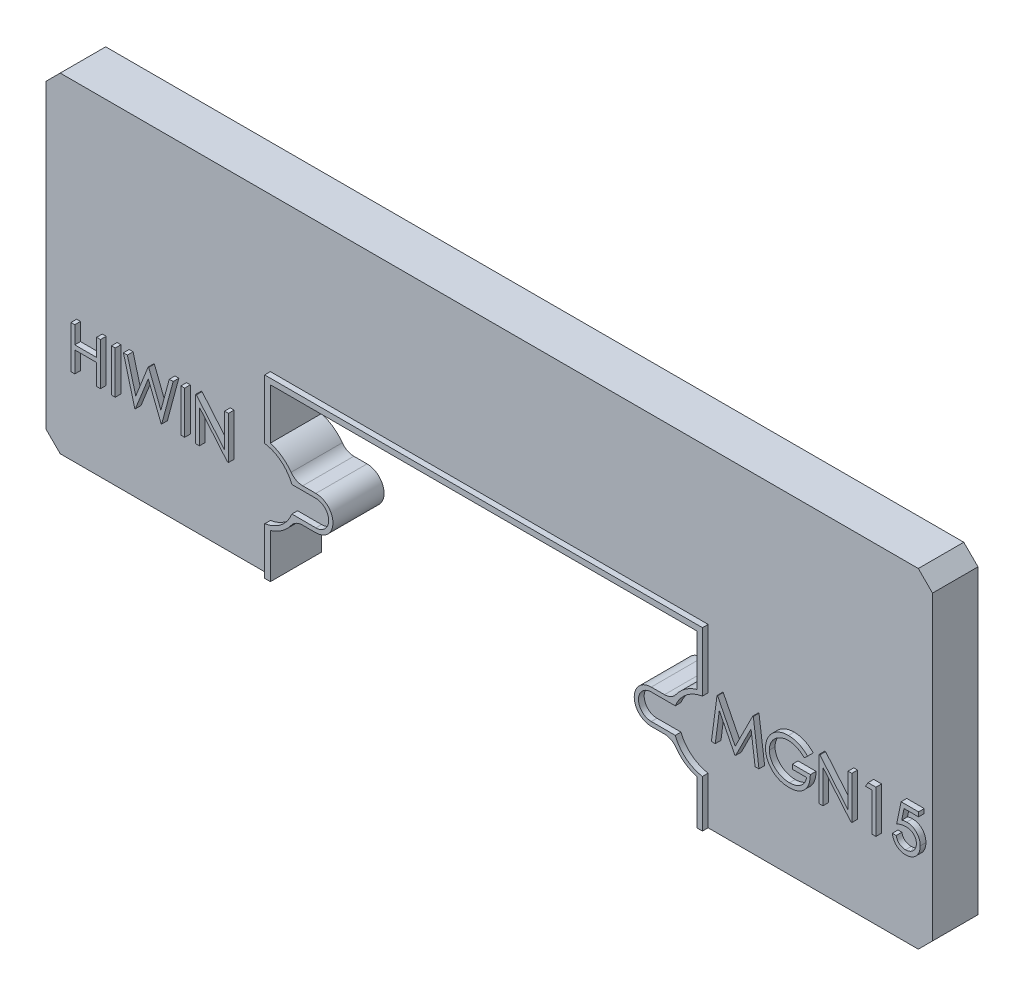
from build123d import *

# Parameters (mm, degrees)
BOSS_EXTRUDE1_DEPTH = 1.6
FILLET1_R           = 0.5
BOSS_EXTRUDE3_START = 0.2
BOSS_EXTRUDE3_DEPTH = 0.2
SKETCH3_W           = 0.134615385
SKETCH3_H           = 1.5
SKETCH3_W_2         = 0.134615384
BOSS_EXTRUDE4_DEPTH = 0.2


with BuildPart() as part:
    # Sketch1 → Boss-Extrude1 (new body)
    with BuildSketch(Plane.XY):
        with BuildLine():
            ThreePointArc((6.647274571, -2.31), (6.997318767, -1.854307057), (7.501849233, -1.579287046))
            Line((7.501849233, -1.579287046), (7.501849233, 0.2))
            Line((7.501849233, 0.2), (-7.501849233, 0.2))
            Line((-7.501849233, 0.2), (-7.501849233, -1.579287046))
            ThreePointArc((-7.501849233, -1.579287046), (-6.997318767, -1.854307057), (-6.647274571, -2.31))
            Line((-6.647274571, -2.31), (-5.9, -2.31))
            ThreePointArc((-5.9, -2.31), (-5.3, -2.91), (-5.9, -3.51))
            Line((-5.9, -3.51), (-6.647274571, -3.51))
            ThreePointArc((-6.647274571, -3.51), (-6.996585307, -3.96506535), (-7.5, -4.240158261))
            Line((-7.5, -4.240158261), (-7.5, -5.8))
            Line((-7.5, -5.8), (-15.095, -5.8))
            Line((-15.095, -5.8), (-15.595, -5.3))
            Line((-15.595, -5.3), (-15.595, 5.3))
            Line((-15.595, 5.3), (-15.095, 5.8))
            Line((-15.095, 5.8), (15.095, 5.8))
            Line((15.095, 5.8), (15.595, 5.3))
            Line((15.595, 5.3), (15.595, -5.3))
            Line((15.595, -5.3), (15.095, -5.8))
            Line((15.095, -5.8), (7.5, -5.8))
            Line((7.5, -5.8), (7.5, -4.240158261))
            ThreePointArc((7.5, -4.240158261), (6.996585307, -3.96506535), (6.647274571, -3.51))
            Line((6.647274571, -3.51), (5.9, -3.51))
            ThreePointArc((5.9, -3.51), (5.3, -2.91), (5.9, -2.31))
            Line((5.9, -2.31), (6.647274571, -2.31))
        make_face()
    extrude(amount=-BOSS_EXTRUDE1_DEPTH)

    # Fillet1
    fillet1_edges = [part.edges().sort_by_distance(p)[0] for p in [
        (-6.647274571, -2.31, -0.8),
        (-6.647274571, -3.51, -0.8),
        (6.647274571, -3.51, -0.8),
        (6.647274571, -2.31, -0.8),
    ]]
    fillet(fillet1_edges, radius=FILLET1_R)

    # Sketch2 → Boss-Extrude3 (add)
    with BuildSketch(Plane.XY.offset(BOSS_EXTRUDE3_START)):
        with BuildLine():
            Line((-7.5, -5.8), (-7.7, -5.8))
            Line((-7.7, -5.8), (-7.7, -4.133764683))
            ThreePointArc((-7.7, -4.133764683), (-7.119615817, -3.87363921), (-6.744534726, -3.36))
            Line((-6.744534726, -3.36), (-5.9, -3.36))
            ThreePointArc((-5.9, -3.36), (-5.45, -2.91), (-5.9, -2.46))
            Line((-5.9, -2.46), (-6.744534726, -2.46))
            ThreePointArc((-6.744534726, -2.46), (-7.120344028, -1.945771518), (-7.701849233, -1.685934531))
            Line((-7.701849233, -1.685934531), (-7.701849233, 0.4))
            Line((-7.701849233, 0.4), (7.701849233, 0.4))
            Line((7.701849233, 0.4), (7.701849233, -1.685934531))
            ThreePointArc((7.701849233, -1.685934531), (7.120344028, -1.945771518), (6.744534726, -2.46))
            Line((6.744534726, -2.46), (5.9, -2.46))
            ThreePointArc((5.9, -2.46), (5.45, -2.91), (5.9, -3.36))
            Line((5.9, -3.36), (6.744534726, -3.36))
            ThreePointArc((6.744534726, -3.36), (7.119615817, -3.87363921), (7.7, -4.133764683))
            Line((7.7, -4.133764683), (7.7, -5.8))
            Line((7.7, -5.8), (7.5, -5.8))
            Line((7.5, -5.8), (7.5, -4.240158261))
            ThreePointArc((7.5, -4.240158261), (7.092189431, -4.039939416), (6.770797719, -3.718840656))
            ThreePointArc((6.770797719, -3.718840656), (6.592812851, -3.565264308), (6.364317416, -3.51))
            Line((6.364317416, -3.51), (5.9, -3.51))
            ThreePointArc((5.9, -3.51), (5.3, -2.91), (5.9, -2.31))
            Line((5.9, -2.31), (6.364317416, -2.31))
            ThreePointArc((6.364317416, -2.31), (6.592812851, -2.254735692), (6.770797719, -2.101159344))
            ThreePointArc((6.770797719, -2.101159344), (7.092974903, -1.779499451), (7.501849233, -1.579287046))
            Line((7.501849233, -1.579287046), (7.501849233, 0.2))
            Line((7.501849233, 0.2), (-7.501849233, 0.2))
            Line((-7.501849233, 0.2), (-7.501849233, -1.579287046))
            ThreePointArc((-7.501849233, -1.579287046), (-7.092974903, -1.779499451), (-6.770797719, -2.101159344))
            ThreePointArc((-6.770797719, -2.101159344), (-6.592812851, -2.254735692), (-6.364317416, -2.31))
            Line((-6.364317416, -2.31), (-5.9, -2.31))
            ThreePointArc((-5.9, -2.31), (-5.3, -2.91), (-5.9, -3.51))
            Line((-5.9, -3.51), (-6.364317416, -3.51))
            ThreePointArc((-6.364317416, -3.51), (-6.592812851, -3.565264308), (-6.770797719, -3.718840656))
            ThreePointArc((-6.770797719, -3.718840656), (-7.092189431, -4.039939416), (-7.5, -4.240158261))
            Line((-7.5, -4.240158261), (-7.5, -5.8))
        make_face()
    extrude(amount=-BOSS_EXTRUDE3_DEPTH)

    # Sketch3 → Boss-Extrude4 (add)
    with BuildSketch(Plane.XY):
        Polygon((-10.132115385, -2.91), (-10.132115385, -1.41), (-10.103870192, -1.41), (-9.112884615, -2.590588942), (-9.112884615, -1.41), (-8.978269231, -1.41), (-8.978269231, -2.91), (-9.008918269, -2.91), (-9.9975, -1.732115385), (-9.9975, -2.91), align=None)
        with Locations((-10.584038462, -2.16)):
            Rectangle(SKETCH3_W, SKETCH3_H)
        Polygon((-12.670576923, -1.41), (-12.531454327, -1.41), (-12.237884615, -2.510060096), (-11.801286058, -1.41), (-11.781754808, -1.41), (-11.353269231, -2.502548077), (-11.058197115, -1.41), (-10.920576923, -1.41), (-11.325024038, -2.91), (-11.344254808, -2.91), (-11.795576923, -1.762764423), (-12.252307692, -2.91), (-12.271538462, -2.91), align=None)
        with Locations((-13.026346154, -2.16)):
            Rectangle(SKETCH3_W_2, SKETCH3_H)
        Polygon((-14.516730769, -1.41), (-14.382115385, -1.41), (-14.382115385, -2.025384615), (-13.612884615, -2.025384615), (-13.612884615, -1.41), (-13.478269231, -1.41), (-13.478269231, -2.91), (-13.612884615, -2.91), (-13.612884615, -2.179230769), (-14.382115385, -2.179230769), (-14.382115385, -2.91), (-14.516730769, -2.91), align=None)
        Polygon((8.015384615, -2.91), (8.213401442, -1.41), (8.232632212, -1.41), (8.851923077, -2.640769231), (9.469711538, -1.41), (9.489242788, -1.41), (9.688461538, -2.91), (9.553245192, -2.91), (9.409615385, -1.830673077), (8.868149038, -2.91), (8.837800481, -2.91), (8.294230769, -1.828269231), (8.150901442, -2.91), align=None)
        with BuildLine():
            Line((11.4, -1.666009615), (11.284615385, -1.775384615))
            add(Edge.make_bspline(
                [(11.284615385, -1.775384615), (11.263735861, -1.755742817), (11.222474698, -1.71692759), (11.155206023, -1.666565735), (11.085021608, -1.623423121), (11.012287681, -1.588320448), (10.938805444, -1.560312122), (10.865550254, -1.54037149), (10.793273525, -1.527654689), (10.74520186, -1.526133959), (10.721514423, -1.525384615)],
                knots=[0, 0, 0, 0, 1.08915593, 2.152340314, 3.188132944, 4.216796309, 5.218260357, 6.173443236, 7.099959455, 8, 8, 8, 8], degree=3))
            add(Edge.make_bspline(
                [(10.721514423, -1.525384615), (10.706979552, -1.525561875), (10.677947506, -1.525915935), (10.634823815, -1.530434884), (10.5921524, -1.536934112), (10.55001381, -1.546337773), (10.508326116, -1.558255942), (10.467234305, -1.573163997), (10.426661725, -1.590544816), (10.386990547, -1.610628734), (10.348530331, -1.632691525), (10.312205973, -1.6571409), (10.277785945, -1.683193238), (10.245917191, -1.711500801), (10.216416397, -1.741807172), (10.18858138, -1.773548588), (10.163391111, -1.807592254), (10.140637754, -1.843311808), (10.120339918, -1.880079889), (10.102421924, -1.917542599), (10.087380314, -1.955575679), (10.075479119, -1.994226855), (10.065660268, -2.033197108), (10.058752722, -2.072756274), (10.054858412, -2.11294671), (10.054184792, -2.139859821), (10.053846154, -2.153389423)],
                knots=[0, 0, 0, 0, 1.02818874, 2.053710826, 3.065248034, 4.081641283, 5.106893873, 6.131558223, 7.173050175, 8.228653731, 9.27666206, 10.308777013, 11.325269123, 12.329503258, 13.32196095, 14.316845687, 15.314881793, 16.315733098, 17.311955233, 18.285320748, 19.252783886, 20.203351036, 21.145449891, 22.095197417, 23.042428769, 24, 24, 24, 24], degree=3))
            add(Edge.make_bspline(
                [(10.053846154, -2.153389423), (10.054170033, -2.167219773), (10.054816907, -2.194842708), (10.058957044, -2.236068739), (10.066640576, -2.276682483), (10.076912451, -2.316817397), (10.089761372, -2.356542217), (10.105778229, -2.395684722), (10.124749201, -2.434243461), (10.146707723, -2.471871011), (10.170787524, -2.508523735), (10.19776313, -2.543049244), (10.226417666, -2.575907292), (10.257795052, -2.606368333), (10.290889141, -2.635247146), (10.326688688, -2.661748084), (10.364489743, -2.686381608), (10.404349976, -2.70883726), (10.445836883, -2.728898061), (10.488375492, -2.746736873), (10.532101698, -2.761428018), (10.576785708, -2.773401491), (10.622374253, -2.783215904), (10.66909874, -2.789529824), (10.716615615, -2.794111609), (10.748646457, -2.79444661), (10.764783654, -2.794615385)],
                knots=[0, 0, 0, 0, 0.93586088, 1.869166235, 2.799637598, 3.729985548, 4.670839027, 5.622275134, 6.589130586, 7.576015415, 8.568469353, 9.55398029, 10.53834874, 11.515998671, 12.510579167, 13.508179873, 14.527009472, 15.561807829, 16.601455013, 17.643573243, 18.680854198, 19.719860599, 20.772568776, 21.833555941, 22.908541556, 24, 24, 24, 24], degree=3))
            add(Edge.make_bspline(
                [(10.764783654, -2.794615385), (10.784231517, -2.794208852), (10.822420556, -2.793410559), (10.878557603, -2.787196149), (10.932473204, -2.77749038), (10.984015863, -2.763276425), (11.033245443, -2.745146278), (11.080342418, -2.723291113), (11.124935986, -2.696872659), (11.167160203, -2.667055287), (11.20605614, -2.633834645), (11.241136479, -2.597987021), (11.271841689, -2.559686421), (11.298629417, -2.519158429), (11.320790269, -2.476067584), (11.338980038, -2.430625057), (11.352922877, -2.382810409), (11.358646438, -2.349771138), (11.361538462, -2.333076923)],
                knots=[0, 0, 0, 0, 1.13008108, 2.219097802, 3.278683437, 4.311054135, 5.322181354, 6.324827112, 7.324222904, 8.330512327, 9.32562643, 10.293043162, 11.24128371, 12.174520618, 13.111833804, 14.052305215, 15.015860969, 16, 16, 16, 16], degree=3))
            Line((11.361538462, -2.333076923), (10.861538462, -2.333076923))
            Line((10.861538462, -2.333076923), (10.861538462, -2.179230769))
            Line((10.861538462, -2.179230769), (11.496153846, -2.179230769))
            add(Edge.make_bspline(
                [(11.496153846, -2.179230769), (11.495422768, -2.207905407), (11.493991917, -2.264026854), (11.483955239, -2.345871256), (11.467748162, -2.42317341), (11.445608028, -2.496014726), (11.416947194, -2.56429198), (11.382073253, -2.628074494), (11.340428058, -2.686950215), (11.293495012, -2.741399788), (11.240823602, -2.78996945), (11.18383705, -2.832657709), (11.122441207, -2.868615973), (11.056694146, -2.897870543), (10.986811103, -2.920702255), (10.912630369, -2.936890073), (10.83425254, -2.946588629), (10.780536822, -2.947827792), (10.753064904, -2.948461538)],
                knots=[0, 0, 0, 0, 1.140356446, 2.231883559, 3.274166699, 4.278491846, 5.25512956, 6.21435461, 7.1637429, 8.11826594, 9.068280886, 10.0076534, 10.945064095, 11.891975133, 12.864533718, 13.863980011, 14.907571808, 16, 16, 16, 16], degree=3))
            add(Edge.make_bspline(
                [(10.753064904, -2.948461538), (10.736131989, -2.948217629), (10.702734823, -2.947736562), (10.653410139, -2.944317699), (10.605445445, -2.939054595), (10.558847727, -2.931106685), (10.51344558, -2.921371833), (10.469465758, -2.908906096), (10.426740725, -2.894476654), (10.385204446, -2.878064222), (10.345233926, -2.859047798), (10.306651133, -2.837915095), (10.269242793, -2.814775083), (10.233263723, -2.789227578), (10.198526456, -2.761463667), (10.16525498, -2.731427701), (10.133263033, -2.699211507), (10.113222834, -2.676334789), (10.103125, -2.664807692)],
                knots=[0, 0, 0, 0, 1.107784379, 2.184907829, 3.233506516, 4.263428166, 5.276301166, 6.270063455, 7.25232949, 8.225834625, 9.190232166, 10.146266622, 11.1027726, 12.066435141, 13.031522626, 14.010570082, 14.99756817, 16, 16, 16, 16], degree=3))
            add(Edge.make_bspline(
                [(10.103125, -2.664807692), (10.088473886, -2.64652027), (10.059414852, -2.610248977), (10.022009928, -2.552134715), (9.990123613, -2.491962489), (9.964251689, -2.429564791), (9.944049652, -2.364999985), (9.929561258, -2.298350575), (9.92107242, -2.229530733), (9.919849475, -2.182959906), (9.919230769, -2.159399038)],
                knots=[0, 0, 0, 0, 1.023165419, 2.029347347, 3.013907458, 3.994755782, 4.975994455, 5.96558838, 6.970761222, 8, 8, 8, 8], degree=3))
            add(Edge.make_bspline(
                [(9.919230769, -2.159399038), (9.919458871, -2.141756359), (9.919912176, -2.106695227), (9.925408826, -2.054642095), (9.933295148, -2.003513227), (9.944886743, -1.953350417), (9.959499428, -1.904120164), (9.977736636, -1.855799608), (9.998970163, -1.808360234), (10.023649661, -1.762128576), (10.05111443, -1.717718114), (10.080921667, -1.675307627), (10.113494639, -1.635669456), (10.14830141, -1.598301607), (10.185757263, -1.563673529), (10.225511301, -1.531464625), (10.267594163, -1.501631688), (10.31213824, -1.474644616), (10.358478676, -1.450403064), (10.406504391, -1.429150545), (10.456200724, -1.411586267), (10.507195357, -1.396683219), (10.559874286, -1.385662444), (10.613855231, -1.377670125), (10.669419564, -1.372201296), (10.706977863, -1.371761472), (10.726021635, -1.371538462)],
                knots=[0, 0, 0, 0, 1.008945113, 2.00506715, 2.99143336, 3.967273523, 4.948097931, 5.927297278, 6.919902385, 7.919676788, 8.923139349, 9.905703106, 10.883022732, 11.856032218, 12.825136022, 13.798837087, 14.781400844, 15.773989409, 16.776158564, 17.77167057, 18.775803737, 19.789618931, 20.80898985, 21.851988756, 22.910860228, 24, 24, 24, 24], degree=3))
            add(Edge.make_bspline(
                [(10.726021635, -1.371538462), (10.74155231, -1.371786815), (10.772347816, -1.372279271), (10.818173129, -1.375692692), (10.863290136, -1.381102927), (10.907765731, -1.388485835), (10.95144846, -1.398541702), (10.994462762, -1.410575253), (11.036870992, -1.424586034), (11.078540242, -1.44129554), (11.119750691, -1.460261379), (11.16073148, -1.481609989), (11.201342586, -1.505706419), (11.241654435, -1.53262222), (11.281921231, -1.561895113), (11.321506078, -1.594362324), (11.361364482, -1.628743505), (11.386993831, -1.653464441), (11.4, -1.666009615)],
                knots=[0, 0, 0, 0, 0.985871117, 1.954866573, 2.915460327, 3.869826059, 4.81536089, 5.759505086, 6.70452669, 7.649098992, 8.607881297, 9.583363685, 10.581137262, 11.603961102, 12.659522466, 13.73993555, 14.853081303, 16, 16, 16, 16], degree=3))
        make_face()
        Polygon((11.803846154, -2.91), (11.803846154, -1.41), (11.832091346, -1.41), (12.823076923, -2.590588942), (12.823076923, -1.41), (12.957692308, -1.41), (12.957692308, -2.91), (12.927043269, -2.91), (11.938461538, -1.732115385), (11.938461538, -2.91), align=None)
        Polygon((13.526502404, -1.41), (13.803846154, -1.41), (13.803846154, -2.91), (13.669230769, -2.91), (13.669230769, -1.563846154), (13.438461538, -1.563846154), align=None)
        with BuildLine():
            Line((15.303846154, -1.41), (15.303846154, -1.563846154))
            Line((15.303846154, -1.563846154), (14.793629808, -1.563846154))
            Line((14.793629808, -1.563846154), (14.712800481, -1.958377404))
            add(Edge.make_bspline(
                [(14.712800481, -1.958377404), (14.72868157, -1.953993002), (14.759448668, -1.945498916), (14.804860037, -1.936067871), (14.847970981, -1.930382681), (14.87594614, -1.929606405), (14.889483173, -1.929230769)],
                knots=[0, 0, 0, 0, 1.100273476, 2.13160584, 3.095893838, 4, 4, 4, 4], degree=3))
            add(Edge.make_bspline(
                [(14.889483173, -1.929230769), (14.906233347, -1.929593313), (14.939168375, -1.930306165), (14.987356495, -1.937151243), (15.033356306, -1.947925492), (15.077071608, -1.962977145), (15.118583272, -1.982224173), (15.15750937, -2.006267005), (15.19443419, -2.034352718), (15.228695302, -2.066643437), (15.259777148, -2.102181273), (15.287105429, -2.140391789), (15.310317968, -2.180903645), (15.328986863, -2.224103905), (15.343894435, -2.269514971), (15.353816718, -2.317614649), (15.360423879, -2.367949558), (15.361162045, -2.402365802), (15.361538462, -2.419915865)],
                knots=[0, 0, 0, 0, 1.052922333, 2.070308379, 3.05430497, 4.020497103, 4.973039431, 5.925935799, 6.892292201, 7.88610001, 8.88166317, 9.857072816, 10.836096531, 11.812156883, 12.81219415, 13.836441305, 14.89672472, 16, 16, 16, 16], degree=3))
            add(Edge.make_bspline(
                [(15.361538462, -2.419915865), (15.361253429, -2.432139674), (15.360687217, -2.456422097), (15.357807822, -2.492483898), (15.352263944, -2.527782255), (15.344820633, -2.562321851), (15.335159597, -2.596037296), (15.323464288, -2.629025094), (15.309151705, -2.661079926), (15.293452544, -2.692505095), (15.275775482, -2.722590169), (15.256156122, -2.750725449), (15.235428054, -2.777332999), (15.213124603, -2.802127456), (15.189038463, -2.824945892), (15.163461334, -2.845923727), (15.136597312, -2.865415725), (15.108030779, -2.882630666), (15.078398286, -2.898471933), (15.047271908, -2.911467735), (15.015360179, -2.923086533), (14.982203804, -2.932347759), (14.947877884, -2.939604568), (14.912325837, -2.944533397), (14.875734122, -2.948123298), (14.850930545, -2.948348023), (14.838401442, -2.948461538)],
                knots=[0, 0, 0, 0, 1.056347294, 2.098418968, 3.122841568, 4.141288669, 5.149314143, 6.15115421, 7.162517403, 8.180376062, 9.185164535, 10.17417709, 11.141909838, 12.097768115, 13.052685741, 14.0056014, 14.954263652, 15.917497458, 16.885230207, 17.854509472, 18.828990115, 19.81800267, 20.826176721, 21.857883937, 22.917946725, 24, 24, 24, 24], degree=3))
            add(Edge.make_bspline(
                [(14.838401442, -2.948461538), (14.823455365, -2.948165465), (14.794050723, -2.947582976), (14.75097048, -2.941489339), (14.709521363, -2.932761946), (14.670037034, -2.919632116), (14.632163636, -2.903180419), (14.596411042, -2.882387774), (14.56186571, -2.858825301), (14.52993198, -2.831019435), (14.500293645, -2.800627), (14.473762284, -2.767645154), (14.450133609, -2.73261825), (14.429786003, -2.695376184), (14.412429708, -2.656016814), (14.398794713, -2.61439267), (14.387789704, -2.57072124), (14.383133952, -2.54065545), (14.380769231, -2.525384615)],
                knots=[0, 0, 0, 0, 1.0467383, 2.05933395, 3.04377827, 4.011590433, 4.970194871, 5.932262533, 6.905835911, 7.896367577, 8.894135286, 9.877477877, 10.858688626, 11.851381753, 12.8477658, 13.868841284, 14.917554742, 16, 16, 16, 16], degree=3))
            Line((14.380769231, -2.525384615), (14.515384615, -2.525384615))
            add(Edge.make_bspline(
                [(14.515384615, -2.525384615), (14.518696854, -2.539688809), (14.525063161, -2.567182264), (14.539037054, -2.605809982), (14.556122429, -2.640232506), (14.576438578, -2.670905185), (14.600674306, -2.697651898), (14.628329775, -2.721487782), (14.659335942, -2.742991409), (14.693790183, -2.760915452), (14.730138646, -2.77620206), (14.768181736, -2.786381358), (14.806883599, -2.793538884), (14.833060043, -2.794255353), (14.846213942, -2.794615385)],
                knots=[0, 0, 0, 0, 1.136247022, 2.183929868, 3.172523383, 4.106158343, 5.02341133, 5.958108904, 6.928429099, 7.938127109, 8.96079061, 9.975095812, 10.982467395, 12, 12, 12, 12], degree=3))
            add(Edge.make_bspline(
                [(14.846213942, -2.794615385), (14.859053276, -2.794263623), (14.884334028, -2.793571), (14.921538908, -2.788239995), (14.957458711, -2.780029608), (14.991739007, -2.767742527), (15.024979667, -2.752809076), (15.056339854, -2.733645472), (15.086726801, -2.711591179), (15.115196002, -2.686324051), (15.141270051, -2.658479897), (15.164308389, -2.628703871), (15.183498495, -2.596939508), (15.199670256, -2.563736728), (15.211950241, -2.528731632), (15.220710661, -2.492088272), (15.225854829, -2.453716137), (15.226562478, -2.427543576), (15.226923077, -2.414206731)],
                knots=[0, 0, 0, 0, 1.027316725, 2.022795036, 3.002884548, 3.971462791, 4.93288096, 5.914575861, 6.907176829, 7.935150275, 8.956128384, 9.956726525, 10.942570165, 11.921478529, 12.907843606, 13.90538589, 14.932640048, 16, 16, 16, 16], degree=3))
            add(Edge.make_bspline(
                [(15.226923077, -2.414206731), (15.226640871, -2.402174266), (15.226088494, -2.378622428), (15.221575393, -2.344165625), (15.213725262, -2.311562892), (15.202829313, -2.280656792), (15.188995239, -2.251418174), (15.172089676, -2.223816863), (15.151795363, -2.198216648), (15.128613125, -2.174605554), (15.103216821, -2.152814893), (15.075169503, -2.134238856), (15.045058106, -2.118611463), (15.013245421, -2.105125178), (14.97897475, -2.095439144), (14.942924764, -2.088167193), (14.904706175, -2.083960609), (14.87857588, -2.083376943), (14.865144231, -2.083076923)],
                knots=[0, 0, 0, 0, 1.045622112, 2.046656509, 3.013763289, 3.955457236, 4.890082067, 5.820317437, 6.762574623, 7.722996705, 8.69280354, 9.665887285, 10.63943826, 11.638615906, 12.663482002, 13.728887084, 14.832589034, 16, 16, 16, 16], degree=3))
            add(Edge.make_bspline(
                [(14.865144231, -2.083076923), (14.853517547, -2.083325748), (14.829511395, -2.083839508), (14.792687326, -2.087622292), (14.753990873, -2.093724847), (14.713570375, -2.102118953), (14.671304443, -2.1131037), (14.627282272, -2.126267058), (14.5814113, -2.142005057), (14.550503704, -2.153890292), (14.534615385, -2.16)],
                knots=[0, 0, 0, 0, 0.817624296, 1.688186739, 2.600797293, 3.572016777, 4.590301741, 5.671205678, 6.80286297, 8, 8, 8, 8], degree=3))
            Line((14.534615385, -2.16), (14.688461538, -1.41))
            Line((14.688461538, -1.41), (15.303846154, -1.41))
        make_face()
    extrude(amount=BOSS_EXTRUDE4_DEPTH)


solid = part.part
